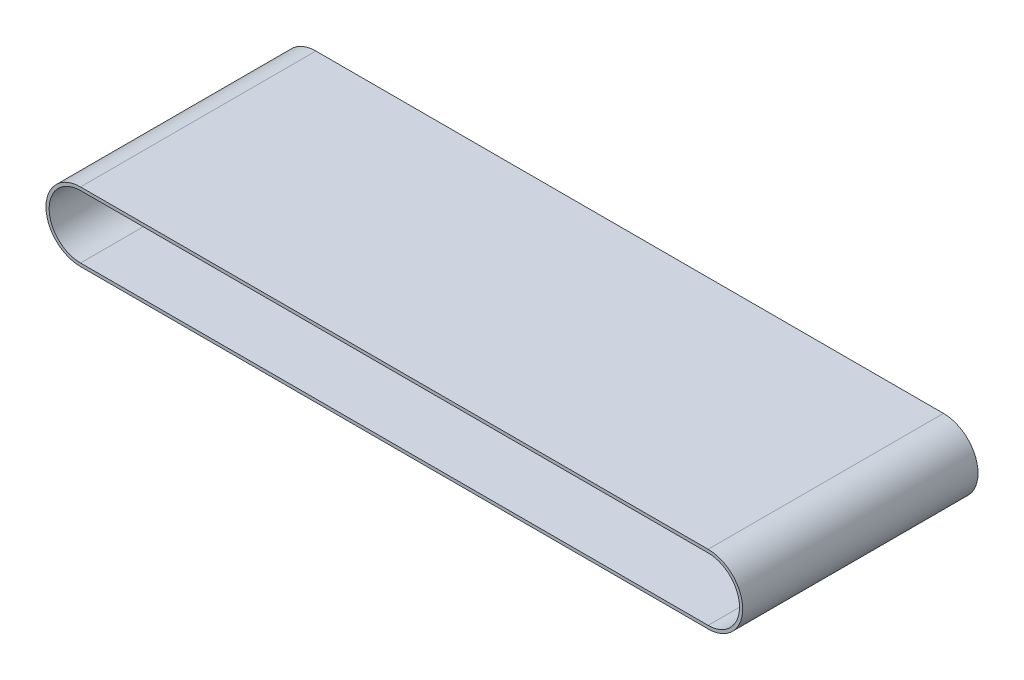
from build123d import *

# Parameters (mm, degrees)
BOSS_EXTRUDE1_DEPTH = 150


with BuildPart() as part:
    # Sketch1 → Boss-Extrude1 (new body)
    with BuildSketch(Plane.XY):
        with BuildLine():
            Line((0, 22), (400, 22))
            ThreePointArc((400, 22), (422, 0), (400, -22))
            Line((400, -22), (0, -22))
            ThreePointArc((0, -22), (-22, 0), (0, 22))
        make_face()
        with BuildLine():
            Line((0, 20), (400, 20))
            ThreePointArc((400, 20), (420, 0), (400, -20))
            Line((400, -20), (0, -20))
            ThreePointArc((0, -20), (-20, 0), (0, 20))
        make_face(mode=Mode.SUBTRACT)
    extrude(amount=BOSS_EXTRUDE1_DEPTH)


solid = part.part
